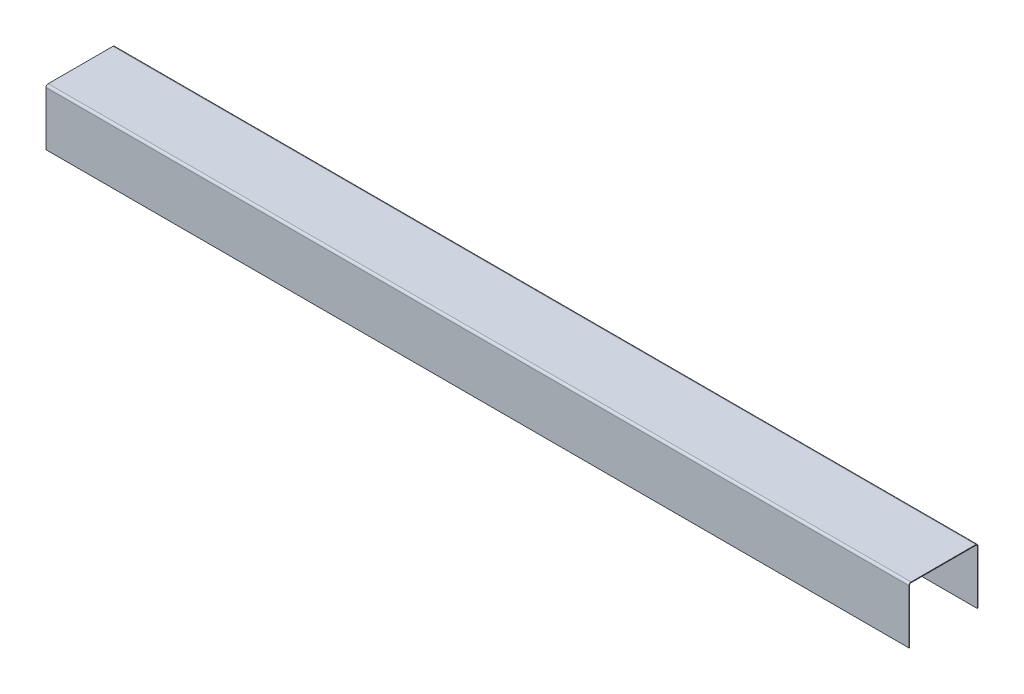
from build123d import *

# Parameters (mm, degrees)
SKETCH1_W               = 1000
SKETCH1_H               = 80
BOSS_EXTRUDE1_DEPTH     = 65
FILLET1_R               = 2.5
CUT_EXTRUDE1_DEPTH      = 993.937560978
CUT_EXTRUDE1_DEPTH_BACK = 65


with BuildPart() as part:
    # Sketch1 → Boss-Extrude1 (new body)
    with BuildSketch(Plane(origin=(0, 0, 0), x_dir=(1, 0, 0), z_dir=(0, 1, 0))):
        with Locations((490, 0)):
            Rectangle(SKETCH1_W, SKETCH1_H)
    extrude(amount=-BOSS_EXTRUDE1_DEPTH)

    # Fillet1
    fillet1_edges = [part.edges().sort_by_distance(p)[0] for p in [
        (490, 0, 40),
        (490, 0, -40),
    ]]
    fillet(fillet1_edges, radius=FILLET1_R)

    # Sketch2 → Cut-Extrude1 (cut, two sides: drawn at the far end of the back side and taken through both)
    with BuildSketch(Plane(origin=(0, 0, 0), x_dir=(0, 0, -1), z_dir=(1, 0, 0)).offset(-CUT_EXTRUDE1_DEPTH_BACK)):
        with BuildLine():
            Line((39.2, -64.2), (39.2, -67.2))
            Line((39.2, -67.2), (-39.2, -67.2))
            Line((-39.2, -67.2), (-39.2, -64.2))
            Line((-39.2, -64.2), (-39.2, -2.5))
            ThreePointArc((-39.2, -2.5), (-38.702081528, -1.297918472), (-37.5, -0.8))
            Line((-37.5, -0.8), (37.5, -0.8))
            ThreePointArc((37.5, -0.8), (38.702081528, -1.297918472), (39.2, -2.5))
            Line((39.2, -2.5), (39.2, -64.2))
        make_face()
    extrude(amount=CUT_EXTRUDE1_DEPTH + CUT_EXTRUDE1_DEPTH_BACK, mode=Mode.SUBTRACT)


solid = part.part
